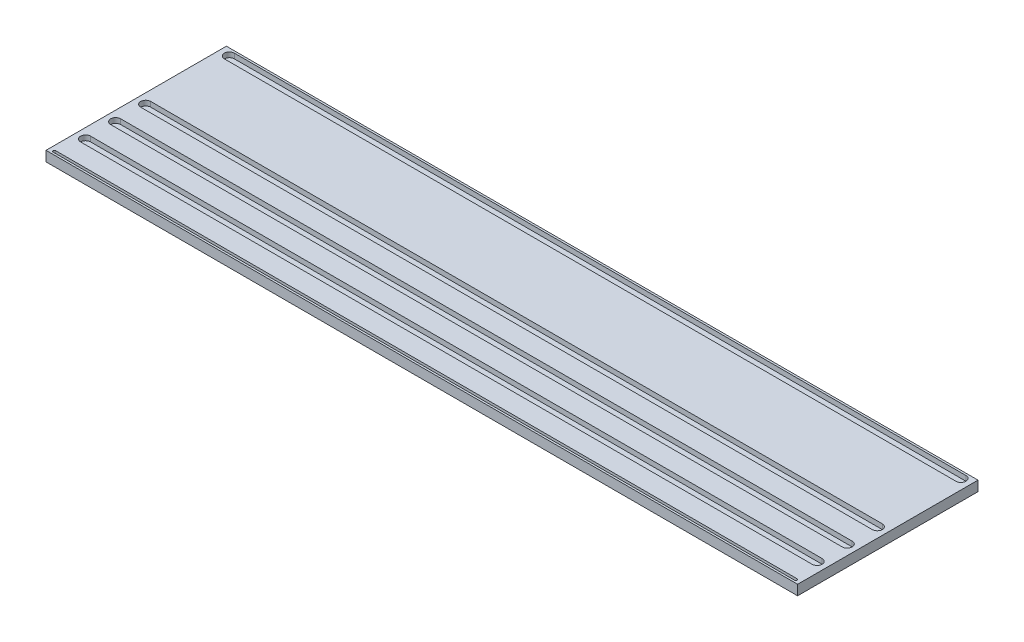
from build123d import *

# Parameters (mm, degrees)
SKETCH1_W           = 476.25
SKETCH1_H           = 114.3
BOSS_EXTRUDE1_DEPTH = 6.35
CUT_EXTRUDE1_DEPTH  = 3.175
SKETCH2_3_W         = 463.55
SKETCH2_3_H         = 6.35
SKETCH2_3_W_2       = 469.9
SKETCH2_3_H_2       = 1.5875
CUT_EXTRUDE2_DEPTH  = 3.175


with BuildPart() as part:
    # Sketch1 → Boss-Extrude1 (new body)
    with BuildSketch(Plane(origin=(0, 0, 0), x_dir=(1, 0, 0), z_dir=(0, 1, 0))):
        with Locations((238.125, 57.15)):
            Rectangle(SKETCH1_W, SKETCH1_H)
    extrude(amount=-BOSS_EXTRUDE1_DEPTH)

    # Sketch2 → Cut-Extrude1 (cut)
    with BuildSketch(Plane(origin=(0, 0, 0), x_dir=(1, 0, 0), z_dir=(0, 1, 0))):
        with BuildLine():
            Line((6.35, 15.5575), (6.35, 21.9075))
            ThreePointArc((6.35, 21.9075), (3.175, 18.7325), (6.35, 15.5575))
        make_face()
        with BuildLine():
            ThreePointArc((469.9, 15.5575), (473.075, 18.7325), (469.9, 21.9075))
            Line((469.9, 21.9075), (469.9, 15.5575))
        make_face()
        with BuildLine():
            Line((469.9, 40.9575), (6.35, 40.9575))
            ThreePointArc((6.35, 40.9575), (3.175, 37.7825), (6.35, 34.6075))
            Line((6.35, 34.6075), (469.9, 34.6075))
            ThreePointArc((469.9, 34.6075), (473.075, 37.7825), (469.9, 40.9575))
        make_face()
        with BuildLine():
            Line((469.9, 60.0075), (6.35, 60.0075))
            ThreePointArc((6.35, 60.0075), (3.175, 56.8325), (6.35, 53.6575))
            Line((6.35, 53.6575), (469.9, 53.6575))
            ThreePointArc((469.9, 53.6575), (473.075, 56.8325), (469.9, 60.0075))
        make_face()
        with BuildLine():
            Line((3.175, 1.27), (3.175, 2.8575))
            ThreePointArc((3.175, 2.8575), (2.38125, 2.06375), (3.175, 1.27))
        make_face()
        with BuildLine():
            ThreePointArc((473.075, 1.27), (473.86875, 2.06375), (473.075, 2.8575))
            Line((473.075, 2.8575), (473.075, 1.27))
        make_face()
        with BuildLine():
            Line((469.9, 113.03), (6.35, 113.03))
            ThreePointArc((6.35, 113.03), (3.175, 109.855), (6.35, 106.68))
            Line((6.35, 106.68), (469.9, 106.68))
            ThreePointArc((469.9, 106.68), (473.075, 109.855), (469.9, 113.03))
        make_face()
    extrude(amount=-CUT_EXTRUDE1_DEPTH, mode=Mode.SUBTRACT)

    # Sketch2<3> → Cut-Extrude2 (cut)
    with BuildSketch(Plane(origin=(0, 0, 0), x_dir=(1, 0, 0), z_dir=(0, 1, 0))):
        with Locations((238.125, 18.7325)):
            Rectangle(SKETCH2_3_W, SKETCH2_3_H)
        with Locations((238.125, 2.06375)):
            Rectangle(SKETCH2_3_W_2, SKETCH2_3_H_2)
    extrude(amount=-CUT_EXTRUDE2_DEPTH, mode=Mode.SUBTRACT)


solid = part.part
